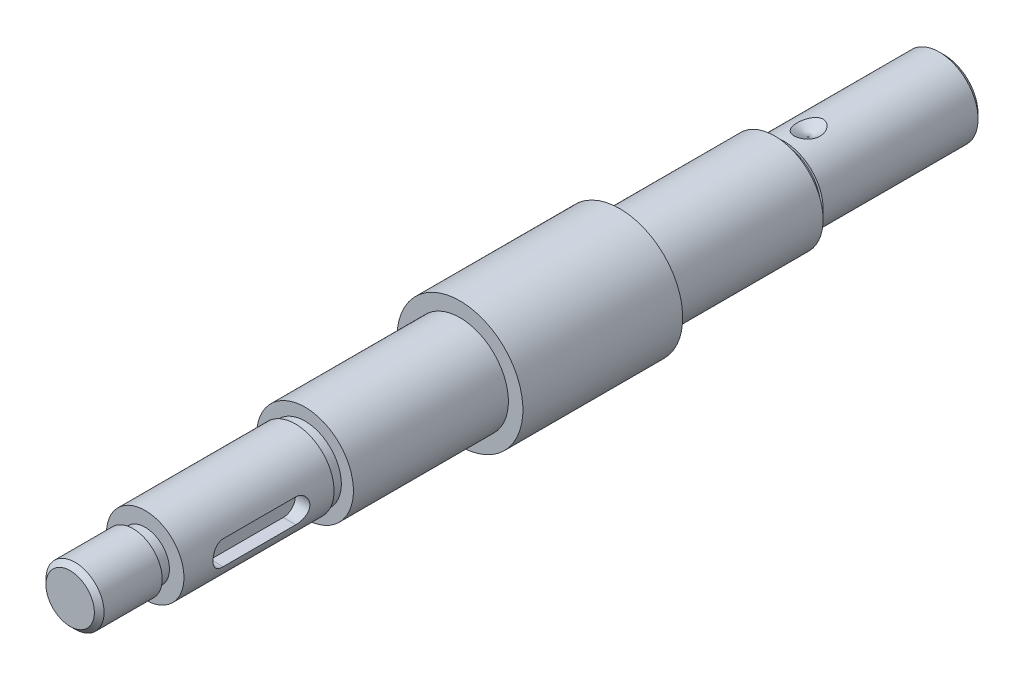
from build123d import *

# Parameters (mm, degrees)
SKETCH_1_R          = 6
EXTRUDE_1_DEPTH     = 13
SKETCH_2_R          = 5
EXTRUDE_2_DEPTH     = 2.5
SKETCH_3_R          = 8
EXTRUDE_3_DEPTH     = 31
SKETCH_4_R          = 7.5
EXTRUDE_4_DEPTH     = 2
SKETCH_5_R          = 10
EXTRUDE_5_DEPTH     = 32
SKETCH_6_R          = 13
EXTRUDE_6_DEPTH     = 33
SKETCH_7_R          = 10
EXTRUDE_7_DEPTH     = 32
SKETCH_8_R          = 7.5
EXTRUDE_8_DEPTH     = 2
SKETCH_9_R          = 8
EXTRUDE_9_DEPTH     = 33
CUT_EXTRUDE_1_DEPTH = 3
CUT_EXTRUDE_2_DEPTH = 3
CHAMFER_1_SIZE      = 1


with BuildPart() as part:
    # 草图1 → 凸台-拉伸1 (new body)
    with BuildSketch(Plane.XY):
        Circle(SKETCH_1_R)
    extrude(amount=-EXTRUDE_1_DEPTH)

    # 草图2 → 凸台-拉伸2 (add)
    with BuildSketch(Plane(origin=(0, 0, -13), x_dir=(-1, 0, 0), z_dir=(0, 0, -1))):
        Circle(SKETCH_2_R)
    extrude(amount=EXTRUDE_2_DEPTH)

    # 草图3 → 凸台-拉伸3 (add)
    with BuildSketch(Plane(origin=(0, 0, -15.5), x_dir=(-1, 0, 0), z_dir=(0, 0, -1))):
        Circle(SKETCH_3_R)
    extrude(amount=EXTRUDE_3_DEPTH)

    # 草图4 → 凸台-拉伸4 (add)
    with BuildSketch(Plane(origin=(0, 0, -46.5), x_dir=(-1, 0, 0), z_dir=(0, 0, -1))):
        Circle(SKETCH_4_R)
    extrude(amount=EXTRUDE_4_DEPTH)

    # 草图5 → 凸台-拉伸5 (add)
    with BuildSketch(Plane(origin=(0, 0, -48.5), x_dir=(-1, 0, 0), z_dir=(0, 0, -1))):
        Circle(SKETCH_5_R)
    extrude(amount=EXTRUDE_5_DEPTH)

    # 草图6 → 凸台-拉伸6 (add)
    with BuildSketch(Plane(origin=(0, 0, -80.5), x_dir=(-1, 0, 0), z_dir=(0, 0, -1))):
        Circle(SKETCH_6_R)
    extrude(amount=EXTRUDE_6_DEPTH)

    # 草图7 → 凸台-拉伸7 (add)
    with BuildSketch(Plane(origin=(0, 0, -113.5), x_dir=(-1, 0, 0), z_dir=(0, 0, -1))):
        Circle(SKETCH_7_R)
    extrude(amount=EXTRUDE_7_DEPTH)

    # 草图8 → 凸台-拉伸8 (add)
    with BuildSketch(Plane(origin=(0, 0, -145.5), x_dir=(-1, 0, 0), z_dir=(0, 0, -1))):
        Circle(SKETCH_8_R)
    extrude(amount=EXTRUDE_8_DEPTH)

    # 草图9 → 凸台-拉伸9 (add)
    with BuildSketch(Plane(origin=(0, 0, -147.5), x_dir=(-1, 0, 0), z_dir=(0, 0, -1))):
        Circle(SKETCH_9_R)
    extrude(amount=EXTRUDE_9_DEPTH)

    # 草图11 → 切除-拉伸1 (cut)
    with BuildSketch(Plane(origin=(8, 0, 0), x_dir=(0, 0, -1), z_dir=(1, 0, 0))):
        with BuildLine():
            Line((24, 2.5), (39, 2.5))
            ThreePointArc((39, 2.5), (41.5, 0), (39, -2.5))
            Line((39, -2.5), (24, -2.5))
            ThreePointArc((24, -2.5), (21.5, 0), (24, 2.5))
        make_face()
    extrude(amount=-CUT_EXTRUDE_1_DEPTH, mode=Mode.SUBTRACT)

    # 草图12 → 切除-拉伸2 (cut)
    with BuildSketch(Plane(origin=(0, -8, 0), x_dir=(1, 0, 0), z_dir=(0, 1, 0))):
        with BuildLine():
            Line((-2.5, 168), (-2.5, 153))
            ThreePointArc((-2.5, 153), (0, 150.5), (2.5, 153))
            Line((2.5, 153), (2.5, 168))
            ThreePointArc((2.5, 168), (0, 170.5), (-2.5, 168))
        make_face()
    extrude(amount=CUT_EXTRUDE_2_DEPTH, mode=Mode.SUBTRACT)

    # 草图18 → 切除-旋转1 (revolve, cut)
    with BuildSketch(Plane(origin=(0, 0, 0), x_dir=(0, 0, -1), z_dir=(1, 0, 0))):
        Polygon((149.5, 8), (152.5, 8), (152.5, 6.267949192), align=None)
    revolve(axis=Axis((0, 8, -152.5), (0, -1, 0)), mode=Mode.SUBTRACT)

    # 倒角1
    chamfer_1_edges = [part.edges().sort_by_distance(p)[0] for p in [
        (-6, 0, 0),
        (8, 0, -180.5),
    ]]
    chamfer(chamfer_1_edges, length=CHAMFER_1_SIZE)


solid = part.part
